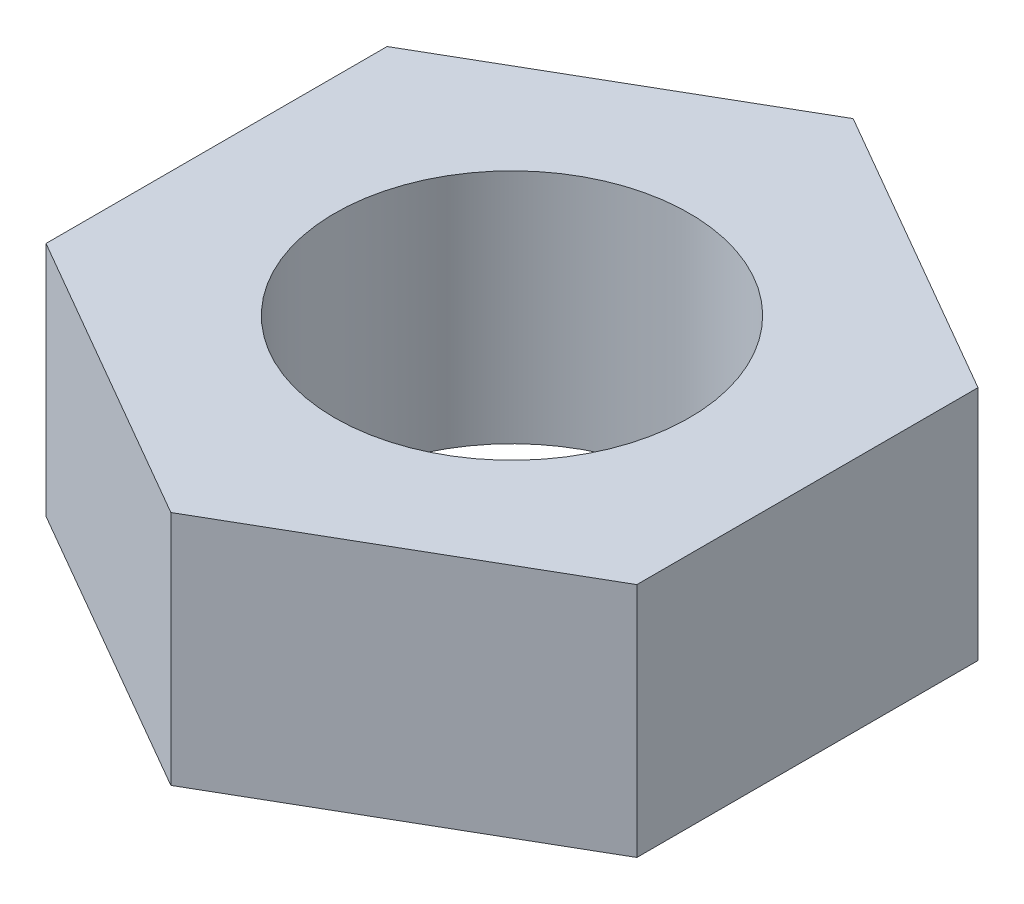
from build123d import *

# Parameters (mm, degrees)
SKETCH1_R           = 1.5
BOSS_EXTRUDE1_DEPTH = 2


with BuildPart() as part:
    # Sketch1 → Boss-Extrude1 (new body)
    with BuildSketch(Plane(origin=(0, 0, 0), x_dir=(1, 0, 0), z_dir=(0, 1, 0))):
        Polygon((0, 2.886751346), (-2.5, 1.443375673), (-2.5, -1.443375673), (0, -2.886751346), (2.5, -1.443375673), (2.5, 1.443375673), align=None)
        with Locations(Location((0, 0, 0), (0, 0, 270))):
            Circle(SKETCH1_R, mode=Mode.SUBTRACT)
    extrude(amount=BOSS_EXTRUDE1_DEPTH)


solid = part.part
